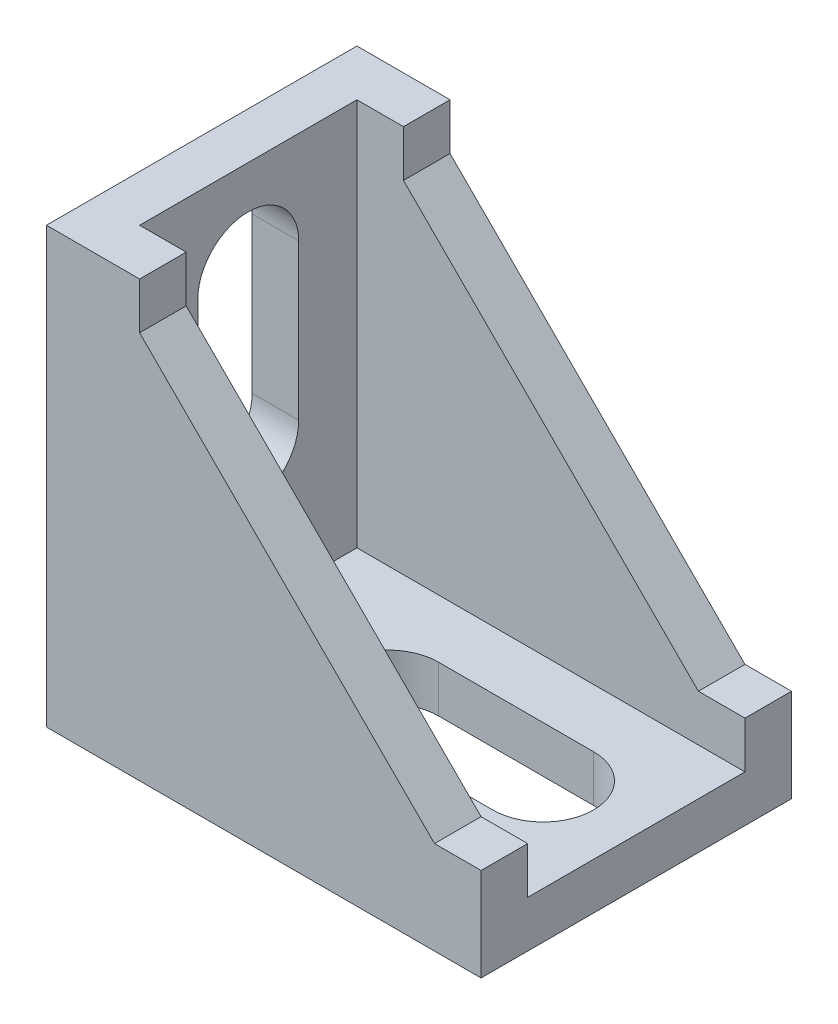
from build123d import *

# Parameters (mm, degrees)
SKETCH1_W           = 28
SKETCH1_H           = 3
SKETCH1_W_2         = 3
SKETCH1_H_2         = 25
BOSS_EXTRUDE1_DEPTH = 10
CUT_EXTRUDE1_DEPTH  = 31.347981811
BOSS_EXTRUDE2_DEPTH = 3


with BuildPart() as part:
    # Sketch1 → Boss-Extrude1 (new, symmetric)
    with BuildSketch(Plane.XY):
        Rectangle(SKETCH1_W, SKETCH1_H)
        with Locations((-12.5, 14)):
            Rectangle(SKETCH1_W_2, SKETCH1_H_2)
    extrude(amount=BOSS_EXTRUDE1_DEPTH, both=True)

    # Sketch3 → Cut-Extrude1 (cut, through all)
    with BuildSketch(Plane(origin=(0, 1.5, 0), x_dir=(1, 0, 0), z_dir=(0, 1, 0))):
        with BuildLine():
            Line((8, -3.25), (-2, -3.25))
            ThreePointArc((-2, -3.25), (-5.25, 0), (-2, 3.25))
            Line((-2, 3.25), (8, 3.25))
            ThreePointArc((8, 3.25), (11.25, 0), (8, -3.25))
        make_face()
    cut_extrude1 = extrude(amount=-CUT_EXTRUDE1_DEPTH, mode=Mode.SUBTRACT)

    # Mirror1: Cut-Extrude1 across plane
    add(cut_extrude1.mirror(Plane(origin=(-6.25, 6.25, 0), x_dir=(0, 0, 1), z_dir=(-0.7071067811865479, 0.7071067811865471, 0))), mode=Mode.SUBTRACT)

    # Sketch4 → Boss-Extrude2 (add)
    with BuildSketch(Plane.XY.offset(10)):
        Polygon((-11, 26.5), (-8, 26.5), (-8, 23.5), (11, 4.5), (14, 4.5), (14, 1.5), (-11, 1.5), align=None)
    boss_extrude2 = extrude(amount=-BOSS_EXTRUDE2_DEPTH)

    # Mirror2: Boss-Extrude2 across plane
    add(boss_extrude2.mirror(Plane.XY))


solid = part.part
